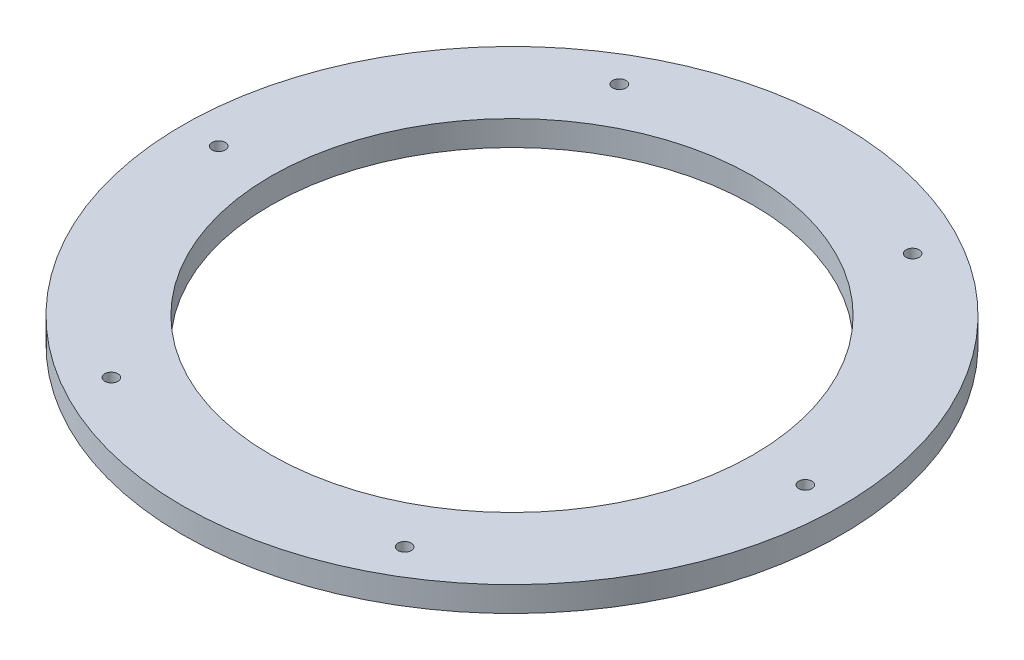
from build123d import *

# Parameters (mm, degrees)
SKETCH1_R           = 250
SKETCH1_R_2         = 183
BOSS_EXTRUDE1_DEPTH = 9.5
SKETCH2_R           = 5
CUT_EXTRUDE1_DEPTH  = 355.063553617


with BuildPart() as part:
    # Sketch1 → Boss-Extrude1 (new, symmetric)
    with BuildSketch(Plane(origin=(0, 0, 0), x_dir=(1, 0, 0), z_dir=(0, 1, 0))):
        with Locations(Location((0, 0, 0), (0, 0, 270))):
            Circle(SKETCH1_R)
        with Locations(Location((0, 0, 0), (0, 0, 270))):
            Circle(SKETCH1_R_2, mode=Mode.SUBTRACT)
    extrude(amount=BOSS_EXTRUDE1_DEPTH, both=True)

    # Sketch2 → Cut-Extrude1 (cut, through all)
    with BuildSketch(Plane(origin=(0, 9.5, 0), x_dir=(1, 0, 0), z_dir=(0, 1, 0))):
        with Locations(Location((111.25, 192.690652342, 0), (0, 0, 270))):
            Circle(SKETCH2_R)
        with Locations(Location((222.5, 0, 0), (0, 0, 270))):
            Circle(SKETCH2_R)
        with Locations(Location((-111.25, 192.690652342, 0), (0, 0, 90))):
            Circle(SKETCH2_R)
        with Locations(Location((-222.5, 0, 0), (0, 0, 90))):
            Circle(SKETCH2_R)
        with Locations(Location((111.25, -192.690652342, 0), (0, 0, 90))):
            Circle(SKETCH2_R)
        with Locations(Location((-111.25, -192.690652342, 0), (0, 0, 270))):
            Circle(SKETCH2_R)
    extrude(amount=-CUT_EXTRUDE1_DEPTH, mode=Mode.SUBTRACT)


solid = part.part
